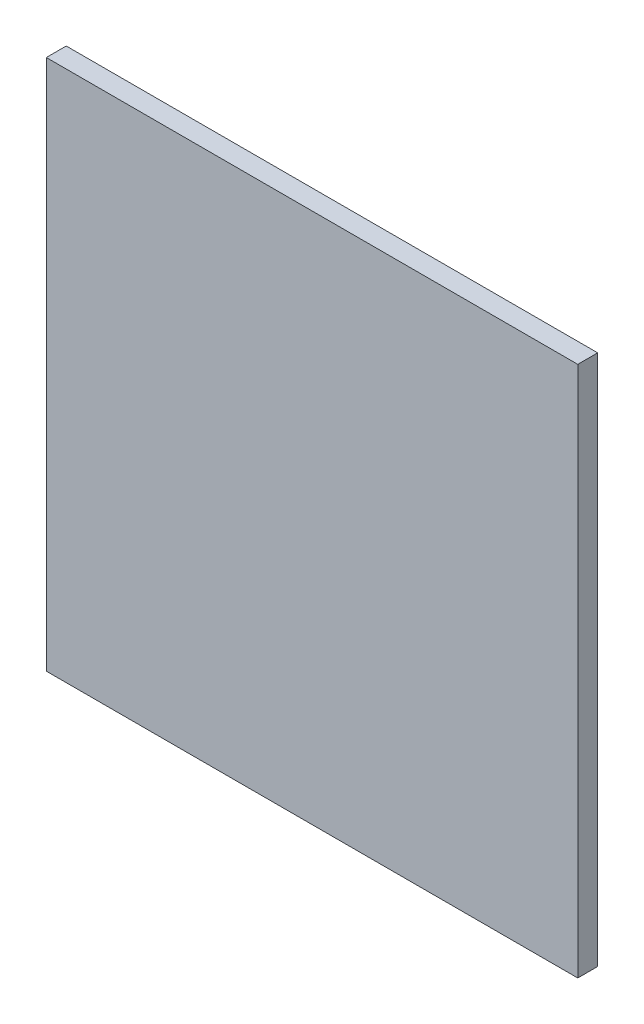
from build123d import *

# Parameters (mm, degrees)
SKETCH1_W           = 800
SKETCH1_H           = 800
BOSS_EXTRUDE1_DEPTH = 30
SKETCH2_R           = 10
CUT_EXTRUDE1_DEPTH  = 15


with BuildPart() as part:
    # Sketch1 → Boss-Extrude1 (new body)
    with BuildSketch(Plane.XY):
        Rectangle(SKETCH1_W, SKETCH1_H)
    extrude(amount=BOSS_EXTRUDE1_DEPTH)

    # Sketch2 → Cut-Extrude1 (cut)
    with BuildSketch(Plane.XY):
        with Locations((-325, -325)):
            Circle(SKETCH2_R)
        with Locations((325, -325)):
            Circle(SKETCH2_R)
        with Locations((-325, 325)):
            Circle(SKETCH2_R)
        with Locations((325, 325)):
            Circle(SKETCH2_R)
    extrude(amount=CUT_EXTRUDE1_DEPTH, mode=Mode.SUBTRACT)


solid = part.part
